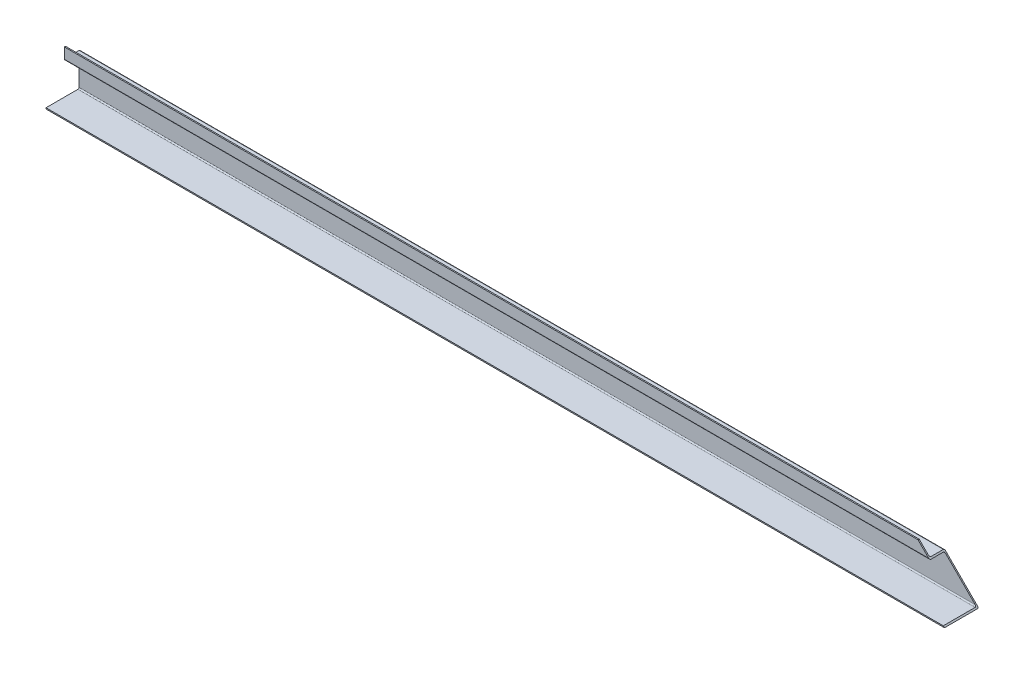
from build123d import *

# Parameters (mm, degrees)
BOSS_EXTRUDE1_DEPTH = 2310
FILLET1_R           = 3
CUT_EXTRUDE1_DEPTH  = 88


with BuildPart() as part:
    # Sketch1 → Boss-Extrude1 (new body)
    with BuildSketch(Plane(origin=(0, 0, 0), x_dir=(0, 0, -1), z_dir=(1, 0, 0))):
        Polygon((0, 0), (85, 0), (85, 82), (47, 82), (47, 112), (50, 112), (50, 85), (88, 85), (88, -3), (0, -3), align=None)
    extrude(amount=BOSS_EXTRUDE1_DEPTH)

    # Fillet1
    fillet1_edges = [part.edges().sort_by_distance(p)[0] for p in [
        (1155, 0, -85),
        (1155, 82, -85),
        (1155, 82, -47),
        (1155, 85, -50),
        (1155, 85, -88),
        (1155, -3, -88),
    ]]
    fillet(fillet1_edges, radius=FILLET1_R)

    # Sketch4 → Cut-Extrude1 (cut)
    with BuildSketch(Plane(origin=(0, 0, -88), x_dir=(-1, 0, 0), z_dir=(0, 0, -1))):
        Polygon((-2310, -3), (-2195, 112), (-2310, 112), align=None)
    extrude(amount=-CUT_EXTRUDE1_DEPTH, mode=Mode.SUBTRACT)


solid = part.part
